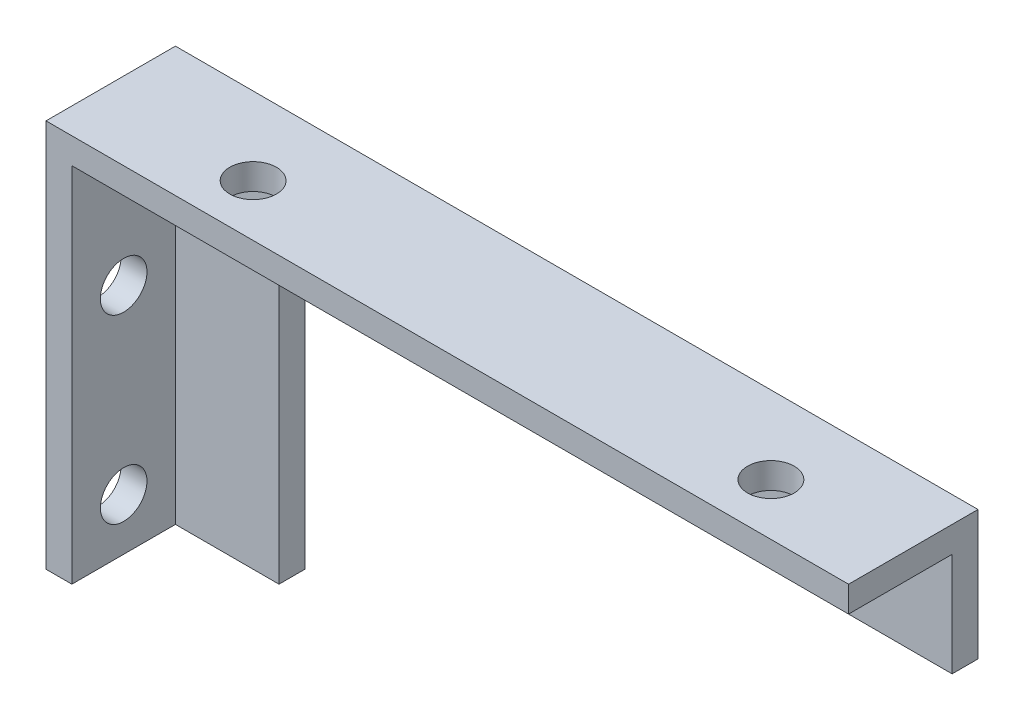
from build123d import *

# Parameters (mm, degrees)
BOSS_EXTRU_1_DEPTH      = 5
ENL_V_MAT_EXTRU_1_DEPTH = 4
ESQUISSE4_R             = 0.9
ENL_V_MAT_EXTRU_2_DEPTH = 10
ESQUISSE3_R             = 0.9
ENL_V_MAT_EXTRU_3_DEPTH = 10


with BuildPart() as part:
    # Esquisse1 → Boss.-Extru.1 (new body)
    with BuildSketch(Plane.XY):
        Polygon((0, 0), (31, 0), (31, -5), (5, -5), (5, -15), (0, -15), align=None)
    extrude(amount=BOSS_EXTRU_1_DEPTH)

    # Esquisse2 → Enlèv. mat.-Extru.1 (cut)
    with BuildSketch(Plane.XY.offset(5)):
        Polygon((1, -15), (5, -15), (5, -5), (31, -5), (31, -1), (1, -1), align=None)
    extrude(amount=-ENL_V_MAT_EXTRU_1_DEPTH, mode=Mode.SUBTRACT)

    # Esquisse4 → Enlèv. mat.-Extru.2 (cut)
    with BuildSketch(Plane.XZ.offset(1)):
        with Locations(Location((26, 3, 0), (0, 0, 270))):
            Circle(ESQUISSE4_R)
        with Locations(Location((6, 3, 0), (0, 0, 270))):
            Circle(ESQUISSE4_R)
    extrude(amount=-ENL_V_MAT_EXTRU_2_DEPTH, mode=Mode.SUBTRACT)

    # Esquisse3 → Enlèv. mat.-Extru.3 (cut)
    with BuildSketch(Plane(origin=(1, 0, 0), x_dir=(0, 0, -1), z_dir=(1, 0, 0))):
        with Locations((-3, -6)):
            Circle(ESQUISSE3_R)
        with Locations((-3, -13)):
            Circle(ESQUISSE3_R)
    extrude(amount=-ENL_V_MAT_EXTRU_3_DEPTH, mode=Mode.SUBTRACT)


solid = part.part
